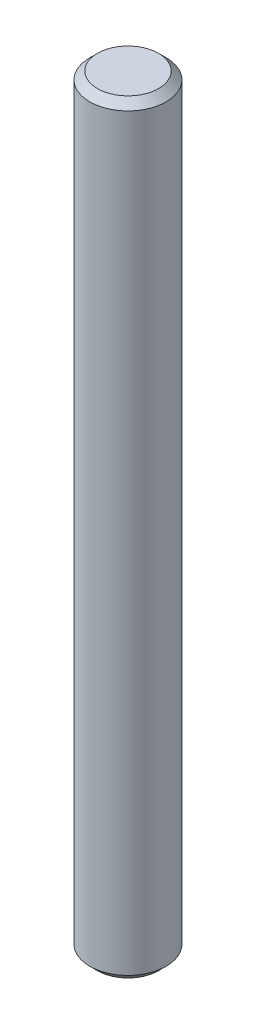
from build123d import *

# Parameters (mm, degrees)
SKETCH1_R           = 2.5
BOSS_EXTRUDE1_DEPTH = 50
CHAMFER1_SIZE       = 0.5


with BuildPart() as part:
    # Sketch1 → Boss-Extrude1 (new body)
    with BuildSketch(Plane(origin=(0, 0, 0), x_dir=(1, 0, 0), z_dir=(0, 1, 0))):
        with Locations(Location((0, 0, 0), (0, 0, 270))):
            Circle(SKETCH1_R)
    extrude(amount=-BOSS_EXTRUDE1_DEPTH)

    # Chamfer1
    chamfer1_edges = [part.edges().sort_by_distance(p)[0] for p in [
        (0, 0, -2.5),
        (0, -50, -2.5),
    ]]
    chamfer(chamfer1_edges, length=CHAMFER1_SIZE)


solid = part.part
